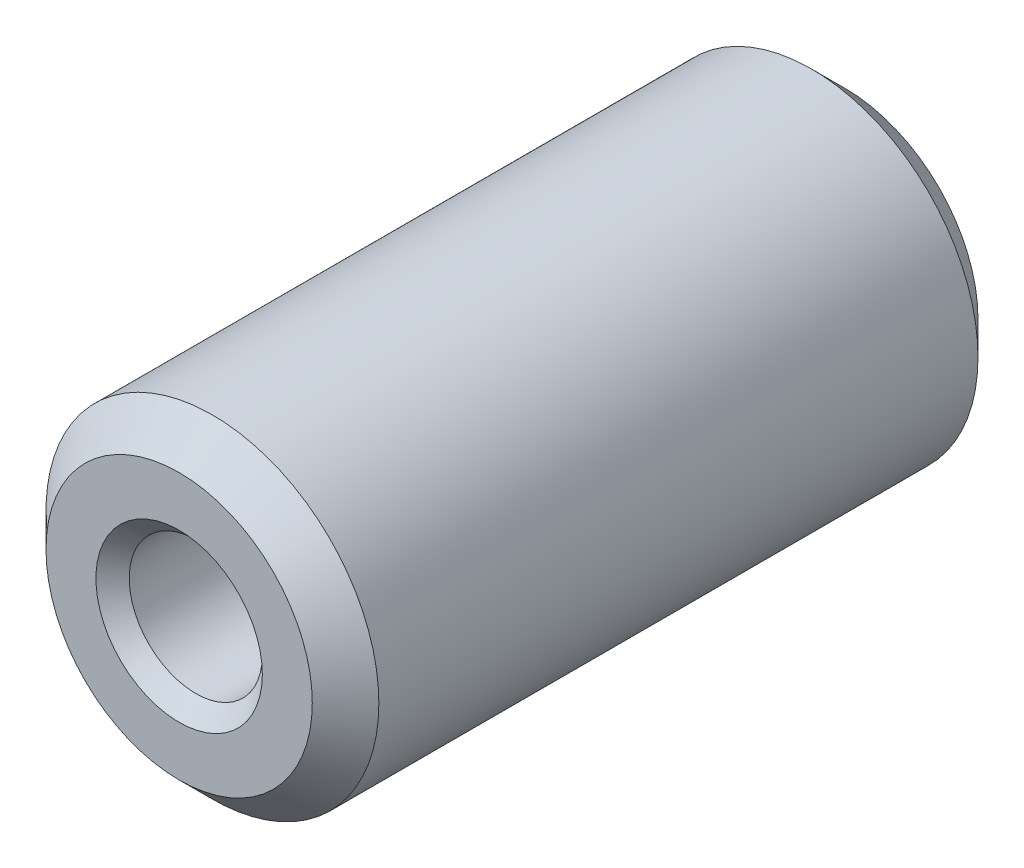
from build123d import *

# Parameters (mm, degrees)
ESQUISSE1_R          = 5
ESQUISSE1_R_2        = 2
BASE_EXTRUSION_DEPTH = 20
CHANFREIN1_SIZE      = 1
CHANFREIN2_SIZE      = 0.5


with BuildPart() as part:
    # Esquisse1 → Base-Extrusion (new body)
    with BuildSketch(Plane.XY):
        Circle(ESQUISSE1_R)
        Circle(ESQUISSE1_R_2, mode=Mode.SUBTRACT)
    extrude(amount=BASE_EXTRUSION_DEPTH)

    # Chanfrein1
    chanfrein1_edges = [part.edges().sort_by_distance(p)[0] for p in [
        (-5, 0, 0),
        (-5, 0, 20),
    ]]
    chamfer(chanfrein1_edges, length=CHANFREIN1_SIZE)

    # Chanfrein2
    chanfrein2_edges = [part.edges().sort_by_distance(p)[0] for p in [
        (-2, 0, 0),
        (-2, 0, 20),
    ]]
    chamfer(chanfrein2_edges, length=CHANFREIN2_SIZE)


solid = part.part
